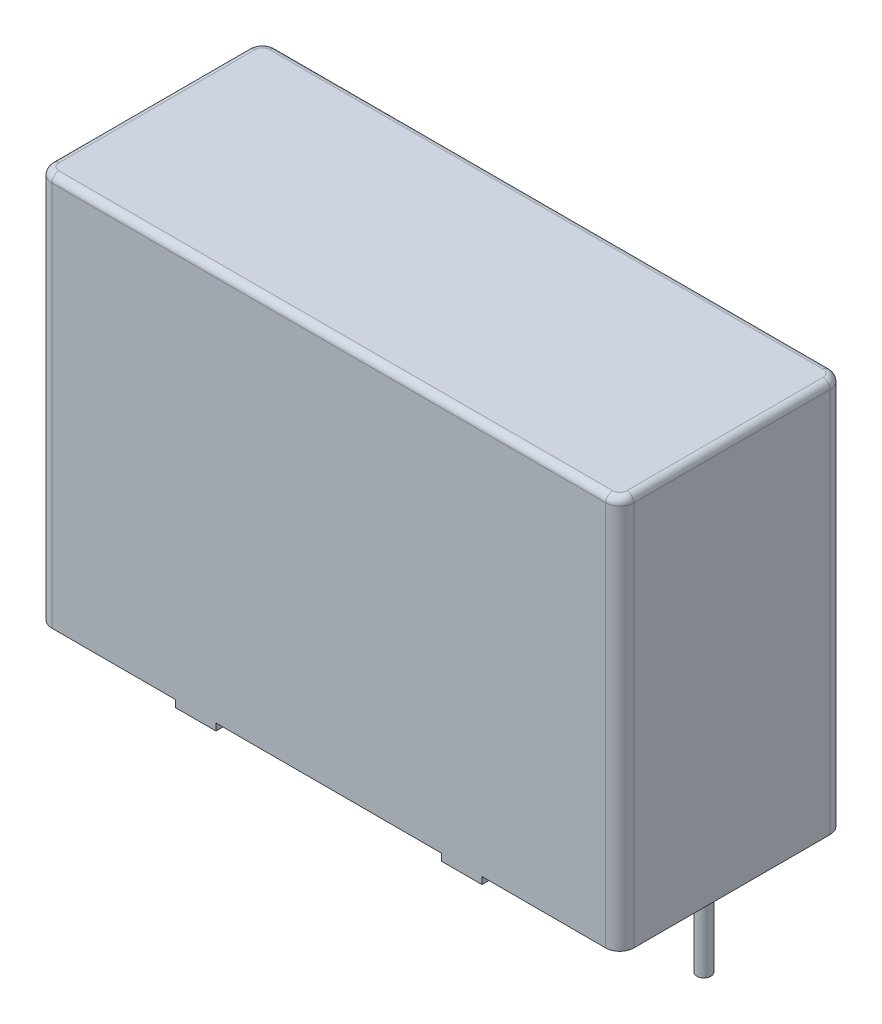
from build123d import *

# Parameters (mm, degrees)
SKETCH_1_W          = 41.5
SKETCH_1_H          = 16
EXTRUDE_1_DEPTH     = 28.5
FILLET_1_R          = 1
FILLET_2_R          = 0.5
CUT_EXTRUDE_START   = -0.5
CUT_EXTRUDE_1_DEPTH = 0.5
SKETCH_4_R          = 0.5
EXTRUDE_2_DEPTH     = 6


with BuildPart() as part:
    # Эскиз1 → Бобышка-Вытянуть1 (new body)
    with BuildSketch(Plane(origin=(0, 0, 0), x_dir=(1, 0, 0), z_dir=(0, 1, 0))):
        Rectangle(SKETCH_1_W, SKETCH_1_H)
    extrude(amount=EXTRUDE_1_DEPTH)

    # Скругление1
    fillet_1_edges = [part.edges().sort_by_distance(p)[0] for p in [
        (20.75, 14.25, 8),
        (-20.75, 14.25, 8),
        (-20.75, 14.25, -8),
        (20.75, 14.25, -8),
    ]]
    fillet(fillet_1_edges, radius=FILLET_1_R)

    # Скругление2
    fillet_2_edges = [part.edges().sort_by_distance(p)[0] for p in [
        (0, 28.5, -8),
        (20.75, 28.5, 0),
        (-20.75, 28.5, 0),
        (0, 28.5, 8),
        (-20.457106781, 28.5, 7.707106781),
        (-20.457106781, 28.5, -7.707106781),
        (20.457106781, 28.5, 7.707106781),
        (20.457106781, 28.5, -7.707106781),
    ]]
    fillet(fillet_2_edges, radius=FILLET_2_R)

    # Эскиз3 → Вырез-Вытянуть1 (cut)
    with BuildSketch(Plane.XZ.offset(CUT_EXTRUDE_START)):
        with BuildLine():
            Line((-10.920111581, 7.5), (-10.920111581, 8))
            Line((-10.920111581, 8), (-19.75, 8))
            ThreePointArc((-19.75, 8), (-20.457106781, 7.707106781), (-20.75, 7))
            Line((-20.75, 7), (-20.75, -7))
            ThreePointArc((-20.75, -7), (-20.457106781, -7.707106781), (-19.75, -8))
            Line((-19.75, -8), (-10.920111581, -8))
            Line((-10.920111581, -8), (-10.920111581, -7.5))
            Line((-10.920111581, -7.5), (-8.050796548, -7.5))
            Line((-8.050796548, -7.5), (-8.050796548, -8))
            Line((-8.050796548, -8), (8.050796548, -8))
            Line((8.050796548, -8), (8.050796548, -7.5))
            Line((8.050796548, -7.5), (10.920111581, -7.5))
            Line((10.920111581, -7.5), (10.920111581, -8))
            Line((10.920111581, -8), (19.75, -8))
            ThreePointArc((19.75, -8), (20.457106781, -7.707106781), (20.75, -7))
            Line((20.75, -7), (20.75, 7))
            ThreePointArc((20.75, 7), (20.457106781, 7.707106781), (19.75, 8))
            Line((19.75, 8), (10.920111581, 8))
            Line((10.920111581, 8), (10.920111581, 7.5))
            Line((10.920111581, 7.5), (8.050796548, 7.5))
            Line((8.050796548, 7.5), (8.050796548, 8))
            Line((8.050796548, 8), (-8.050796548, 8))
            Line((-8.050796548, 8), (-8.050796548, 7.5))
            Line((-8.050796548, 7.5), (-10.920111581, 7.5))
        make_face()
    extrude(amount=CUT_EXTRUDE_1_DEPTH, mode=Mode.SUBTRACT)

    # Эскиз4 → Бобышка-Вытянуть2 (add)
    with BuildSketch(Plane.XZ.offset(-0.5)):
        with Locations(Location((-18.75, 0, 0), (0, 0, 270))):
            Circle(SKETCH_4_R)
        with Locations(Location((18.75, 0, 0), (0, 0, 270))):
            Circle(SKETCH_4_R)
    extrude(amount=EXTRUDE_2_DEPTH)


solid = part.part
